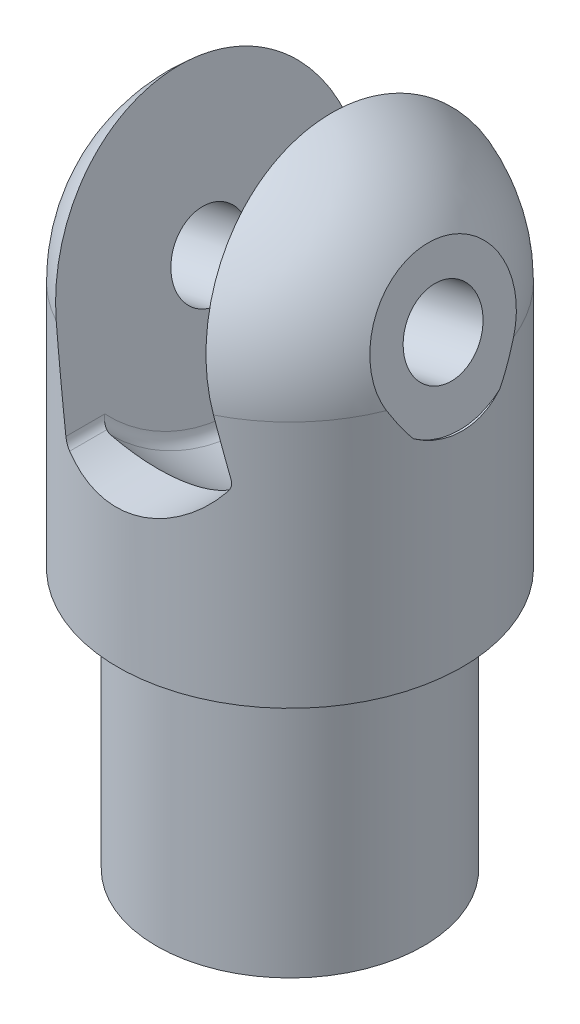
from build123d import *

# Parameters (mm, degrees)
SKETCH1_R                     = 12.9921
BOSS_EXTRUDE1_DEPTH           = 25.4
CUT_EXTRUDE1_DEPTH            = 104.344307451
CUT_EXTRUDE1_DEPTH_BACK       = 104.344307451
SKETCH3_R                     = 3.81
CUT_REVOLVE10_ANGLE           = 180
CUT_REVOLVE10_OTHER_WAY_ANGLE = 90
CUT_EXTRUDE4_DEPTH            = 32.004
FILLET1_R                     = 1.27
SKETCH15_R                    = 7.62
CUT_EXTRUDE5_DEPTH            = 10.16


with BuildPart() as part:
    # Sketch1 → Boss-Extrude1 (new body)
    with BuildSketch(Plane(origin=(0, 0, 0), x_dir=(1, 0, 0), z_dir=(0, 1, 0))):
        Circle(SKETCH1_R)
    extrude(amount=BOSS_EXTRUDE1_DEPTH)

    # Sketch2 → Revolve1 (revolve)
    with BuildSketch(Plane(origin=(0, 0, 0), x_dir=(0, 0, -1), z_dir=(1, 0, 0))):
        with BuildLine():
            Line((-16.764, 25.4), (-16.764, 49.53))
            ThreePointArc((-16.764, 49.53), (-11.85393808, 61.38393808), (0, 66.294))
            Line((0, 66.294), (0, 25.4))
            Line((0, 25.4), (-16.764, 25.4))
        make_face()
    revolve(axis=Axis((0, 25.4, 0), (0, 1, 0)))

    # Sketch3 → Cut-Extrude1 (cut, two sides: drawn at the far end of the back side and taken through both)
    with BuildSketch(Plane(origin=(-10.366451402, 98.300319395, 0), x_dir=(0, 0, -1), z_dir=(-0.9781476007338062, -0.20791169081775643, 0)).offset(-CUT_EXTRUDE1_DEPTH_BACK)):
        with Locations((0, 49.859877342)):
            Circle(SKETCH3_R)
    extrude(amount=CUT_EXTRUDE1_DEPTH + CUT_EXTRUDE1_DEPTH_BACK, mode=Mode.SUBTRACT)

    # Sketch11 → Cut-Revolve10 (revolve, cut)
    with BuildSketch(Plane.XY):
        with BuildLine():
            Line((-7.701934208, 47.892903347), (-11.162976054, 64.175825024))
            ThreePointArc((-11.162976054, 64.175825024), (-4.101170935, 67.482510185), (3.695979409, 67.570287171))
            Line((3.695979409, 67.570287171), (7.205035227, 51.061477515))
            Line((7.205035227, 51.061477515), (-7.701934208, 47.892903347))
        make_face()
    revolve(axis=Axis((17.487516564, 53.247086393, 0), (-0.9781476007338064, -0.2079116908177564, 0)), revolution_arc=CUT_REVOLVE10_ANGLE, mode=Mode.SUBTRACT)

    # Sketch11 → Cut-Revolve10 other way (revolve, cut)
    with BuildSketch(Plane.XY):
        with BuildLine():
            Line((-7.701934208, 47.892903347), (-11.162976054, 64.175825024))
            ThreePointArc((-11.162976054, 64.175825024), (-4.101170935, 67.482510185), (3.695979409, 67.570287171))
            Line((3.695979409, 67.570287171), (7.205035227, 51.061477515))
            Line((7.205035227, 51.061477515), (-7.701934208, 47.892903347))
        make_face()
    revolve(axis=Axis((17.487516564, 53.247086393, 0), (0.9781476007338064, 0.2079116908177564, 0)), revolution_arc=CUT_REVOLVE10_OTHER_WAY_ANGLE, mode=Mode.SUBTRACT)

    # Sketch13 → Cut-Revolve11 (revolve, cut)
    with BuildSketch(Plane.XY):
        with BuildLine():
            Line((-8.49407775, 51.619645705), (6.412891685, 54.788219873))
            Line((6.412891685, 54.788219873), (2.927360083, 71.186356794))
            ThreePointArc((2.927360083, 71.186356794), (-4.869286819, 71.216520857), (-11.979609352, 68.017782626))
            Line((-11.979609352, 68.017782626), (-8.49407775, 51.619645705))
        make_face()
    revolve(axis=Axis((-8.49407775, 51.619645705, 0), (0.9781476007338064, 0.20791169081775632, 0)), mode=Mode.SUBTRACT)

    # Sketch14 → Cut-Extrude4 (cut)
    with BuildSketch(Plane.XY):
        with BuildLine():
            Line((-7.701934208, 47.892903347), (-6.149656223, 40.590009601))
            ThreePointArc((-6.149656223, 40.590009601), (1.969552427, 39.042311826), (8.757313212, 43.758583769))
            Line((8.757313212, 43.758583769), (7.205035227, 51.061477515))
            Line((7.205035227, 51.061477515), (-7.701934208, 47.892903347))
        make_face()
    extrude(amount=CUT_EXTRUDE4_DEPTH, mode=Mode.SUBTRACT)

    # Fillet1
    fillet1_edges = [part.edges().sort_by_distance(p)[0] for p in [
        (-4.840027967, 34.428693074, -9.361457334),
        (-4.624719256, 33.415745227, 0),
        (-5.306564153, 36.623573262, 6.782727573),
        (-6.149656223, 40.590009601, 14.000445211),
        (8.757313212, 43.758583769, 13.350191985),
        (9.600405282, 39.79214743, 6.782727573),
        (10.306257166, 36.471375406, 0),
        (10.298585015, 36.507470038, -7.966497668),
    ]]
    fillet(fillet1_edges, radius=FILLET1_R)

    # Sketch15 → Cut-Extrude5 (cut)
    with BuildSketch(Plane(origin=(-4.834136469, -1.027527427, 0), x_dir=(0, 0, -1), z_dir=(-0.9781476007338062, -0.20791169081775643, 0))):
        with Locations((0, -48.447650664)):
            Circle(SKETCH15_R)
    cut_extrude5 = extrude(amount=CUT_EXTRUDE5_DEPTH, mode=Mode.SUBTRACT)

    # Mirror1: Cut-Extrude5 across plane
    add(cut_extrude5.mirror(Plane(origin=(10.072832966, 2.141046741, 0), x_dir=(0, 0, 1), z_dir=(-0.9781476007338062, -0.20791169081775643, 0))), mode=Mode.SUBTRACT)


solid = part.part
